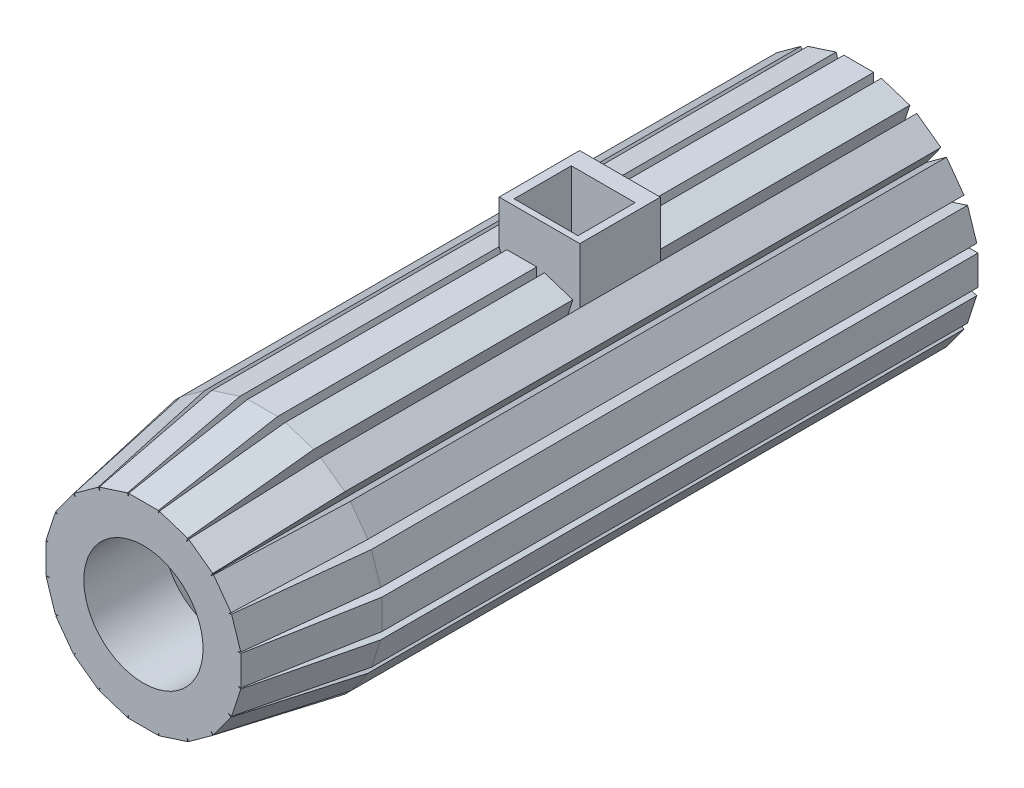
from build123d import *

# Parameters (mm, degrees)
SKETCH1_R                       = 1500
BOSS_EXTRUDE1_DEPTH             = 12000
CHAMFER1_SIZE                   = 2000
CHAMFER1_SIZE2                  = 1154.700538379
SHELL1_T                        = -100
BOSS_EXTRUDE4_REACH             = 12591.678
SKETCH4_W                       = 500
SKETCH4_H                       = 12000
CUT_EXTRUDE1_DEPTH              = 12291.748553282
CIRPATTERN2_COUNT               = 20
SKETCH12_R                      = 1000
CUT_EXTRUDE3_DEPTH              = 12000
SKETCH14_W                      = 1353.586115667
SKETCH14_H                      = 1350
BOSS_EXTRUDE5_DEPTH             = 0.008
BOSS_EXTRUDE5_DIRECTION_2_REACH = 13043.856
CUT_EXTRUDE5_REACH              = 13043.856
CUT_EXTRUDE5_END_RADIUS         = 1400
SKETCH16_W                      = 1071.488727216
SKETCH16_H                      = 959.542143775
CUT_EXTRUDE5_DIRECTION_2_DEPTH  = 13042.855696181


with BuildPart() as part:
    # Sketch1 → Boss-Extrude1 (new body)
    with BuildSketch(Plane.XY):
        Circle(SKETCH1_R)
    extrude(amount=BOSS_EXTRUDE1_DEPTH)

    # Chamfer1
    chamfer1_edges = [part.edges().sort_by_distance(p)[0] for p in [
        (-1500, 0, 12000),
    ]]
    chamfer1_side = [part.faces().sort_by_distance(p)[0] for p in [
        (-1500, 0, 6000),
    ]]
    chamfer(chamfer1_edges, length=CHAMFER1_SIZE, length2=CHAMFER1_SIZE2, reference=chamfer1_side[0])

    # Shell1
    shell1_openings = [part.faces().sort_by_distance(p)[0] for p in [
        (0, 0, 0),
    ]]
    offset(amount=SHELL1_T, openings=shell1_openings, kind=Kind.INTERSECTION)

    # Sketch4 → Boss-Extrude4 (add, up to next)
    with BuildSketch(Plane(origin=(0, 2000, 0), x_dir=(1, 0, 0), z_dir=(0, 1, 0)), mode=Mode.PRIVATE) as boss_extrude4_sk1:
        with Locations((0, -6000)):
            Rectangle(SKETCH4_W, SKETCH4_H)
    boss_extrude4_tool1 = extrude(boss_extrude4_sk1.sketch, amount=-BOSS_EXTRUDE4_REACH, mode=Mode.PRIVATE) - part.part
    boss_extrude4 = boss_extrude4_tool1.solids().sort_by_distance((0, 2000, 6000))[0]
    add(boss_extrude4)

    # Sketch6 → Cut-Extrude1 (cut, symmetric)
    with BuildSketch(Plane.ZY.offset(250)):
        Polygon((10000, 2000), (12000, 1634.848069607), (12000, 2000), align=None)
    cut_extrude1 = extrude(amount=CUT_EXTRUDE1_DEPTH, both=True, mode=Mode.SUBTRACT)

    # CirPattern2: Boss-Extrude4, Cut-Extrude1 ×20 about axis
    cirpattern2_axis = Axis((0, 0, 0), (0, 0, 1))
    add([boss_extrude4.rotate(cirpattern2_axis, i * 360 / CIRPATTERN2_COUNT) for i in range(1, CIRPATTERN2_COUNT)])
    add([cut_extrude1.rotate(cirpattern2_axis, i * 360 / CIRPATTERN2_COUNT) for i in range(1, CIRPATTERN2_COUNT)], mode=Mode.SUBTRACT)

    # Sketch12 → Cut-Extrude3 (cut)
    with BuildSketch(Plane.XY):
        with Locations(Location((0, 0, 0), (0, 0, 180))):
            Circle(SKETCH12_R)
    extrude(amount=CUT_EXTRUDE3_DEPTH, mode=Mode.SUBTRACT)

    # Sketch14 → Boss-Extrude5 (add)
    with BuildSketch(Plane(origin=(0, 2700, 0), x_dir=(1, 0, 0), z_dir=(0, 1, 0))):
        with Locations((296.523198158, -4978.020012277)):
            Rectangle(SKETCH14_W, SKETCH14_H)
    extrude(amount=BOSS_EXTRUDE5_DEPTH)

    # Sketch14 → Boss-Extrude5 direction 2 (add, up to next)
    with BuildSketch(Plane(origin=(0, 2700, 0), x_dir=(1, 0, 0), z_dir=(0, 1, 0)), mode=Mode.PRIVATE) as boss_extrude5_direction_2_sk1:
        with Locations((296.523198158, -4978.020012277)):
            Rectangle(SKETCH14_W, SKETCH14_H)
    boss_extrude5_direction_2_tool1 = extrude(boss_extrude5_direction_2_sk1.sketch, amount=-BOSS_EXTRUDE5_DIRECTION_2_REACH, mode=Mode.PRIVATE) - part.part
    add(boss_extrude5_direction_2_tool1.solids().sort_by_distance((296.523198, 2700, 4978.020012))[0])

    # Cut-Extrude5: up to this cylinder (the profile starts outside it)
    cut_extrude5_end = Plane(origin=(0, 0, 5073.730104), z_dir=(0, 0, -1)) * Cylinder(CUT_EXTRUDE5_END_RADIUS, 28888.712, mode=Mode.PRIVATE)
    # Sketch16 → Cut-Extrude5 (cut, up to the surface)
    with BuildSketch(Plane(origin=(0, 2700, 0), x_dir=(1, 0, 0), z_dir=(0, 1, 0)), mode=Mode.PRIVATE) as cut_extrude5_sk1:
        with Locations((307.415913762, -5073.730104283)):
            Rectangle(SKETCH16_W, SKETCH16_H)
    cut_extrude5_tool1 = extrude(cut_extrude5_sk1.sketch, amount=-CUT_EXTRUDE5_REACH, mode=Mode.PRIVATE) - cut_extrude5_end
    add(cut_extrude5_tool1.solids().sort_by_distance((307.415914, 2700, 5073.730104))[0], mode=Mode.SUBTRACT)

    # Sketch16 → Cut-Extrude5 direction 2 (cut)
    with BuildSketch(Plane(origin=(0, 2700, 0), x_dir=(1, 0, 0), z_dir=(0, 1, 0))):
        with Locations((307.415913762, -5073.730104283)):
            Rectangle(SKETCH16_W, SKETCH16_H)
    extrude(amount=CUT_EXTRUDE5_DIRECTION_2_DEPTH, mode=Mode.SUBTRACT)


solid = part.part
